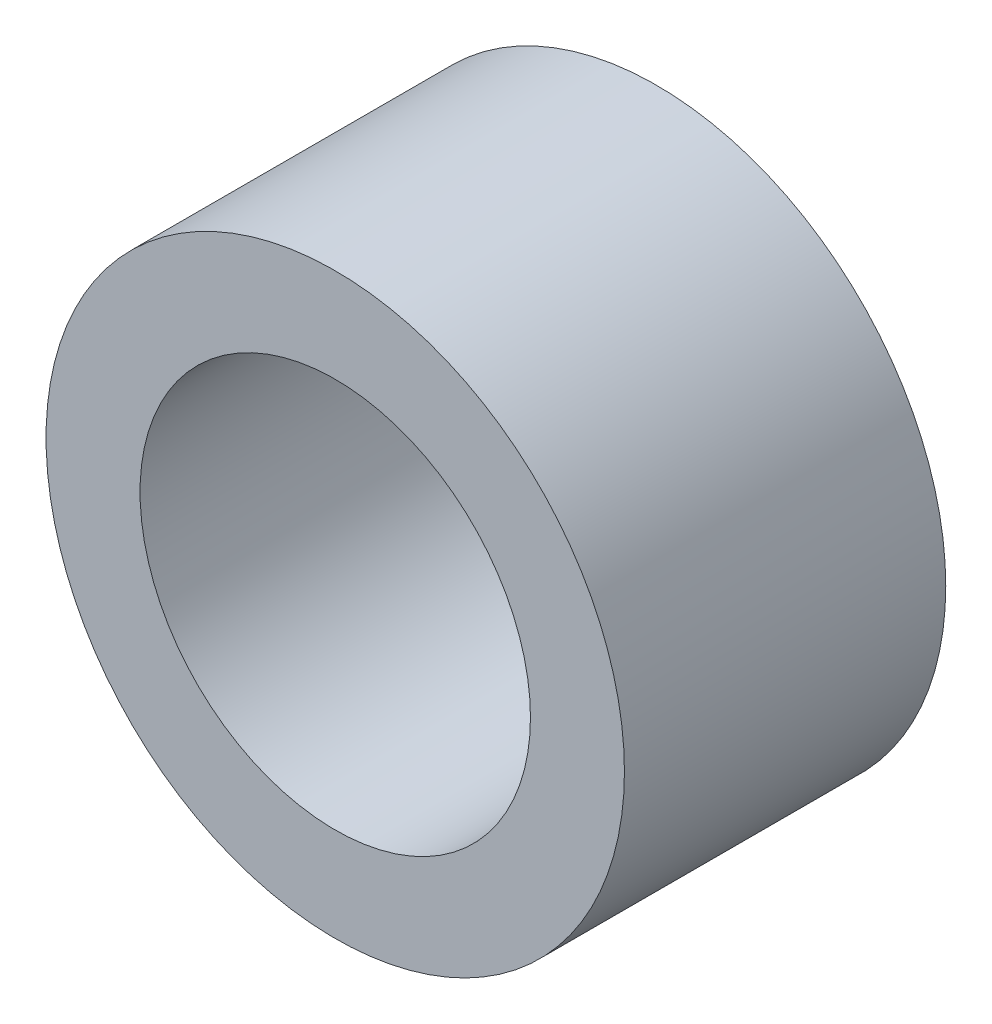
from build123d import *

# Parameters (mm, degrees)
SKETCH_1_R      = 36
SKETCH_1_R_2    = 24.3
EXTRUDE_1_DEPTH = 40


with BuildPart() as part:
    # 草图1 → 凸台-拉伸1 (new body)
    with BuildSketch(Plane.XY):
        Circle(SKETCH_1_R)
        Circle(SKETCH_1_R_2, mode=Mode.SUBTRACT)
    extrude(amount=EXTRUDE_1_DEPTH)


solid = part.part
